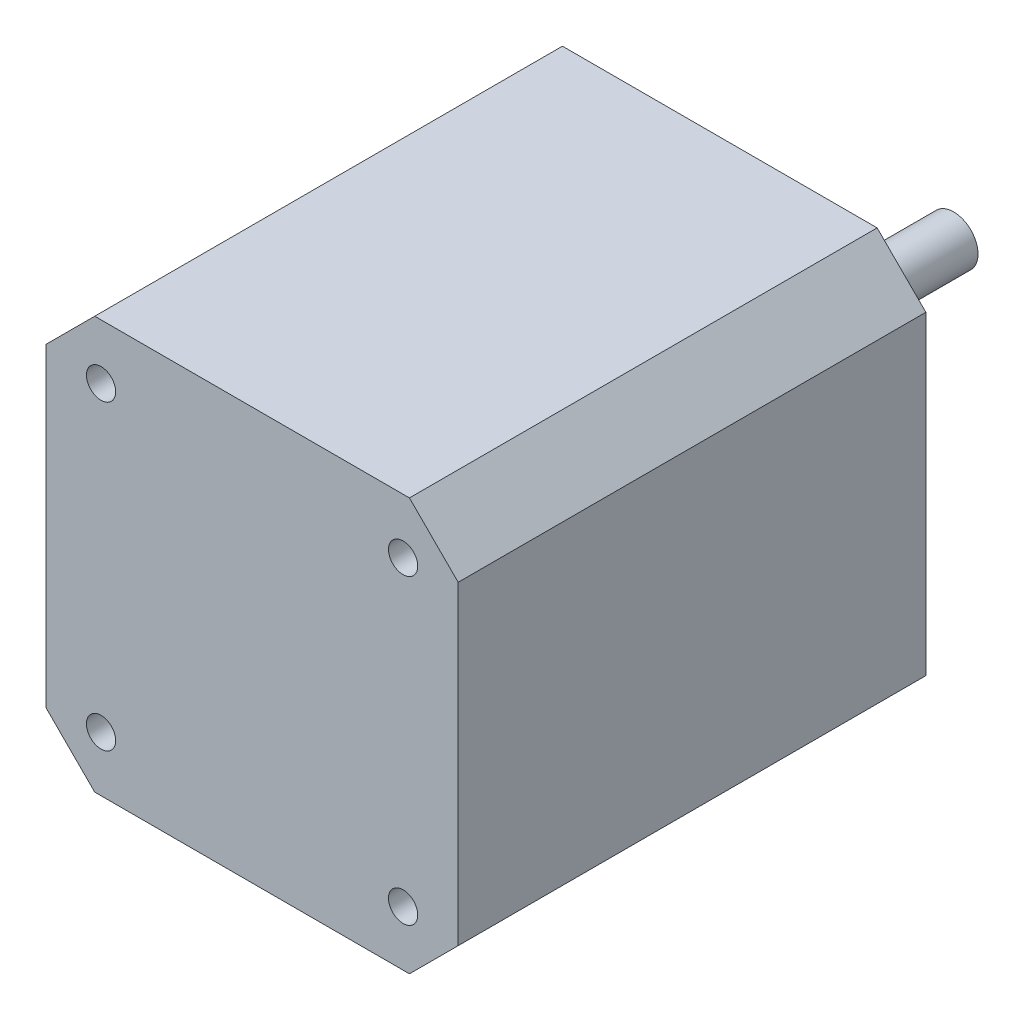
from build123d import *

# Parameters (mm, degrees)
SKETCH1_R           = 1.5
BOSS_EXTRUDE1_DEPTH = 48
SKETCH1_5_R         = 11
BOSS_EXTRUDE2_DEPTH = 2
BOSS_EXTRUDE3_DEPTH = 24


with BuildPart() as part:
    # Sketch1 → Boss-Extrude1 (new body)
    with BuildSketch(Plane.XY):
        Polygon((-21.15, 16.15), (-16.15, 21.15), (16.15, 21.15), (21.15, 16.15), (21.15, -16.15), (16.15, -21.15), (-16.15, -21.15), (-21.15, -16.15), align=None)
        with Locations((-15.5, 15.5)):
            Circle(SKETCH1_R, mode=Mode.SUBTRACT)
        with Locations((-15.5, -15.5)):
            Circle(SKETCH1_R, mode=Mode.SUBTRACT)
        with Locations((15.5, -15.5)):
            Circle(SKETCH1_R, mode=Mode.SUBTRACT)
        with Locations((15.5, 15.5)):
            Circle(SKETCH1_R, mode=Mode.SUBTRACT)
    extrude(amount=BOSS_EXTRUDE1_DEPTH)

    # Sketch1<5> → Boss-Extrude2 (add)
    with BuildSketch(Plane.XY):
        Circle(SKETCH1_5_R)
    extrude(amount=-BOSS_EXTRUDE2_DEPTH)

    # Sketch1<6> → Boss-Extrude3 (add)
    with BuildSketch(Plane.XY):
        with BuildLine():
            Line((-1.767766953, 1.767766953), (-1.767766953, -1.767766953))
            ThreePointArc((-1.767766953, -1.767766953), (2.5, 0), (-1.767766953, 1.767766953))
        make_face()
    extrude(amount=-BOSS_EXTRUDE3_DEPTH)


solid = part.part
